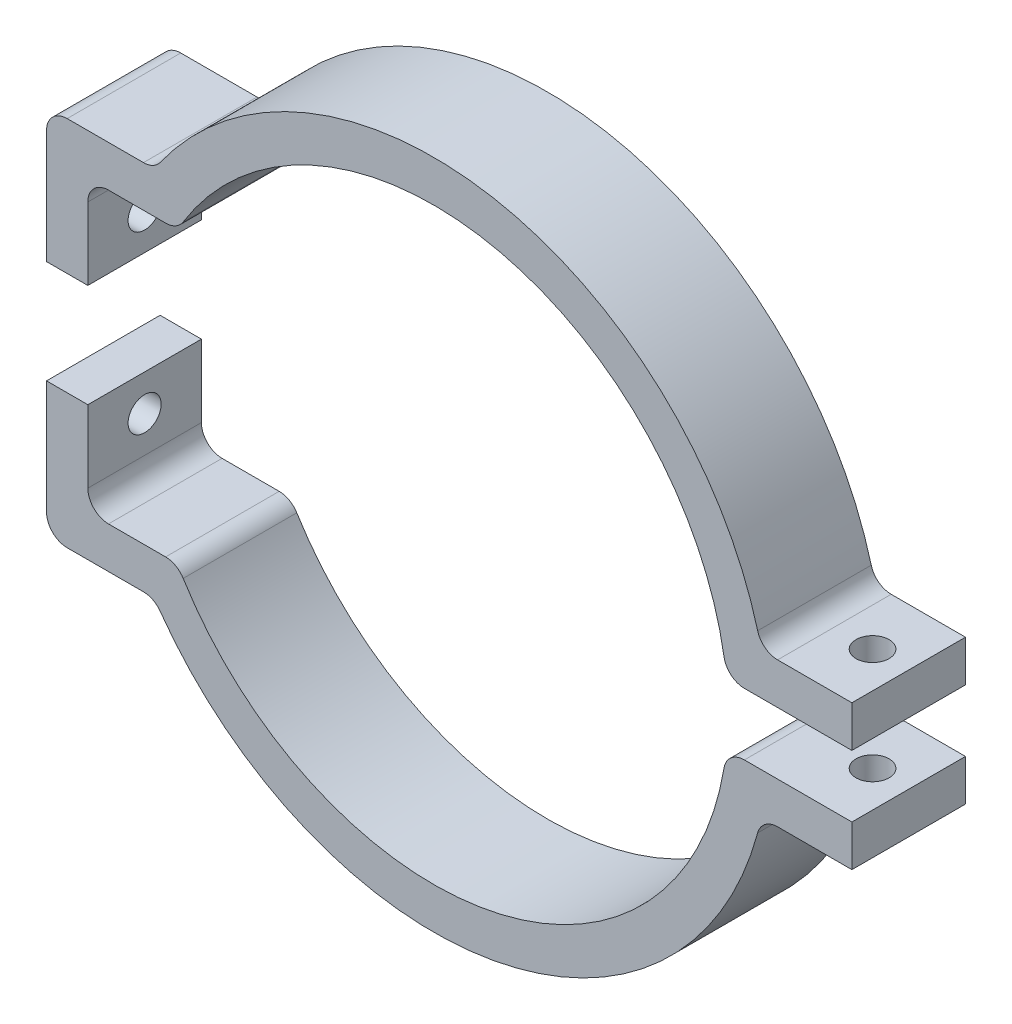
from build123d import *

# Parameters (mm, degrees)
EXTRUDE_1_DEPTH          = 11
CUT_EXTRUDE_1_DEPTH      = 58.632456134
CUT_EXTRUDE_1_DEPTH_BACK = 58.632456134
SKETCH_3_R               = 1.6
CUT_EXTRUDE_4_REACH      = 87.213
SKETCH_5_R               = 1.6
SKETCH_5_W               = 11
SKETCH_5_H               = 10
FILLET_1_R               = 2
FILLET_2_R               = 2


with BuildPart() as part:
    # 草图1 → 凸台-拉伸1 (new body)
    with BuildSketch(Plane.XY):
        with BuildLine():
            Line((-37.5, 18), (-37.5, 14))
            Line((-37.5, 14), (-37.5, -14))
            Line((-37.5, -14), (-37.5, -18))
            Line((-37.5, -18), (-27.060118255, -18))
            ThreePointArc((-27.060118255, -18), (5.976518922, -31.945754359), (31.737202145, -7))
            Line((31.737202145, -7), (40.5, -7))
            Line((40.5, -7), (40.5, -3))
            Line((40.5, -3), (28.341665442, -3))
            ThreePointArc((28.341665442, -3), (5.774324085, -27.908908638), (-24.824383175, -14))
            Line((-24.824383175, -14), (-33.5, -14))
            Line((-33.5, -14), (-33.5, 14))
            Line((-33.5, 14), (-24.824383175, 14))
            ThreePointArc((-24.824383175, 14), (5.774324085, 27.908908638), (28.341665442, 3))
            Line((28.341665442, 3), (40.5, 3))
            Line((40.5, 3), (40.5, 7))
            Line((40.5, 7), (31.737202145, 7))
            ThreePointArc((31.737202145, 7), (5.976518922, 31.945754359), (-27.060118255, 18))
            Line((-27.060118255, 18), (-37.5, 18))
        make_face()
    extrude(amount=EXTRUDE_1_DEPTH)

    # 草图3 → 切除-拉伸1 (cut, two sides: drawn at the far end of the back side and taken through both)
    with BuildSketch(Plane(origin=(0, 7, 0), x_dir=(1, 0, 0), z_dir=(0, 1, 0)).offset(-CUT_EXTRUDE_1_DEPTH_BACK)):
        with Locations(Location((37, -5.5, 0), (0, 0, 270))):
            Circle(SKETCH_3_R)
    extrude(amount=CUT_EXTRUDE_1_DEPTH + CUT_EXTRUDE_1_DEPTH_BACK, mode=Mode.SUBTRACT)

    # 草图5 → 切除-拉伸4 (cut, up to next)
    with BuildSketch(Plane.ZY.offset(37.5), mode=Mode.PRIVATE) as cut_extrude_4_sk1:
        with Locations((5.5, 8.5)):
            Circle(SKETCH_5_R)
    cut_extrude_4_tool1 = extrude(cut_extrude_4_sk1.sketch, amount=-CUT_EXTRUDE_4_REACH, mode=Mode.PRIVATE) & part.part
    # 草图5 → 切除-拉伸4 (cut, up to next)
    with BuildSketch(Plane.ZY.offset(37.5), mode=Mode.PRIVATE) as cut_extrude_4_sk2:
        with Locations((5.5, -8.5)):
            Circle(SKETCH_5_R)
    cut_extrude_4_tool2 = extrude(cut_extrude_4_sk2.sketch, amount=-CUT_EXTRUDE_4_REACH, mode=Mode.PRIVATE) & part.part
    # 草图5 → 切除-拉伸4 (cut, up to next)
    with BuildSketch(Plane.ZY.offset(37.5), mode=Mode.PRIVATE) as cut_extrude_4_sk3:
        with Locations((5.5, 0)):
            Rectangle(SKETCH_5_W, SKETCH_5_H)
    cut_extrude_4_tool3 = extrude(cut_extrude_4_sk3.sketch, amount=-CUT_EXTRUDE_4_REACH, mode=Mode.PRIVATE) & part.part
    add(cut_extrude_4_tool1.solids().sort_by_distance((-37.5, 8.5, 5.5))[0], mode=Mode.SUBTRACT)
    add(cut_extrude_4_tool2.solids().sort_by_distance((-37.5, -8.5, 5.5))[0], mode=Mode.SUBTRACT)
    add(cut_extrude_4_tool3.solids().sort_by_distance((-37.5, 0, 5.5))[0], mode=Mode.SUBTRACT)


with BuildPart() as cut_extrude_4_piece_1:
    # of the separate pieces the step leaves, piece 1, a body of its own (cut_extrude_4_pieces)
    add(part.part.solids().sort_by_distance((-37.5, -5, 0))[0])

    # 圆角2
    fillet_2_edges = [cut_extrude_4_piece_1.edges().sort_by_distance(p)[0] for p in [
        (-33.5, -14, 5.5),
        (-37.5, -18, 5.5),
        (-27.060118255, -18, 5.5),
        (31.737202145, -7, 5.5),
        (28.341665442, -3, 5.5),
        (-24.824383175, -14, 5.5),
    ]]
    fillet(fillet_2_edges, radius=FILLET_2_R)


with BuildPart() as cut_extrude_4_piece_2:
    # of the separate pieces the step leaves, piece 2, a body of its own (cut_extrude_4_pieces)
    add(part.part.solids().sort_by_distance((-27.060118255, 18, 0))[0])

    # 圆角1
    fillet_1_edges = [cut_extrude_4_piece_2.edges().sort_by_distance(p)[0] for p in [
        (31.737202145, 7, 5.5),
        (28.341665442, 3, 5.5),
        (-24.824383175, 14, 5.5),
        (-33.5, 14, 5.5),
        (-37.5, 18, 5.5),
        (-27.060118255, 18, 5.5),
    ]]
    fillet(fillet_1_edges, radius=FILLET_1_R)


solid = Compound([cut_extrude_4_piece_1.part, cut_extrude_4_piece_2.part])
